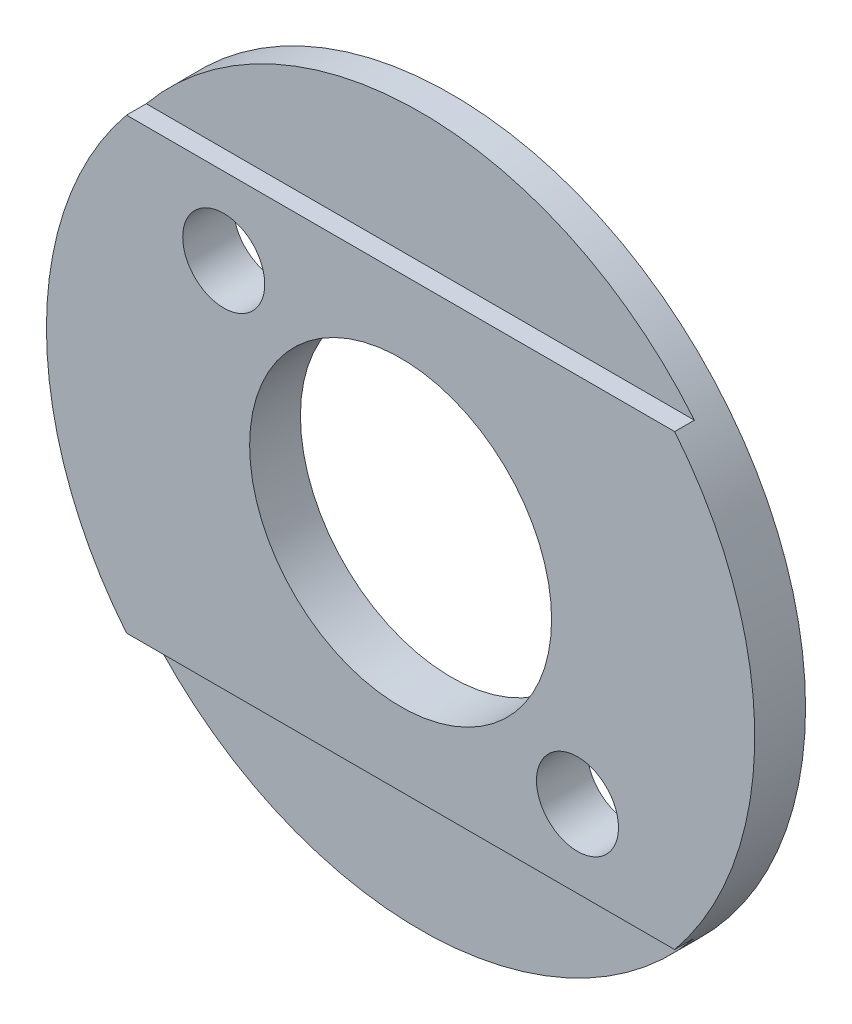
from build123d import *
from build123d.topology import SkipClean

# Parameters (mm, degrees)
SKETCH1_R           = 3.3
SKETCH1_R_2         = 12.15
BOSS_EXTRUDE1_DEPTH = 1.5875
BOSS_EXTRUDE2_START = 2.5
SKETCH2_R           = 28.5
SKETCH2_R_2         = 3.3
SKETCH2_R_3         = 12.15
BOSS_EXTRUDE2_DEPTH = 2.5


with BuildPart() as part:
    # Sketch1 → Boss-Extrude1 (new body)
    with BuildSketch(Plane.XY):
        with BuildLine():
            Line((-4.652672523, -60.083596209), (-48.763782235, -60.083596209))
            ThreePointArc((-48.763782235, -60.083596209), (-55.208227379, -78.133596209), (-48.763782235, -96.183596209))
            Line((-48.763782235, -96.183596209), (-4.652672523, -96.183596209))
            ThreePointArc((-4.652672523, -96.183596209), (0.132351167, -87.716567737), (1.791772621, -78.133596209))
            ThreePointArc((1.791772621, -78.133596209), (0.132351167, -68.550624681), (-4.652672523, -60.083596209))
        make_face()
        with Locations((-12.47433561, -89.950800833)):
            Circle(SKETCH1_R, mode=Mode.SUBTRACT)
        with Locations((-26.708227379, -78.133596209)):
            Circle(SKETCH1_R_2, mode=Mode.SUBTRACT)
        with Locations((-40.942119147, -66.316391585)):
            Circle(SKETCH1_R, mode=Mode.SUBTRACT)
    extrude(amount=BOSS_EXTRUDE1_DEPTH)

    # Sketch2 → Boss-Extrude2 (add)
    with SkipClean():  # the faces are left unmerged after this step: merging them gives an invalid solid
        with BuildSketch(Plane(origin=(0, 0, 0), x_dir=(-1, 0, 0), z_dir=(0, 0, -1)).offset(BOSS_EXTRUDE2_START)):
            with Locations((26.708227379, -78.133596209)):
                Circle(SKETCH2_R)
            with Locations((40.942119147, -66.316391585)):
                Circle(SKETCH2_R_2, mode=Mode.SUBTRACT)
            with Locations((12.47433561, -89.950800833)):
                Circle(SKETCH2_R_2, mode=Mode.SUBTRACT)
            with Locations((26.708227379, -78.133596209)):
                Circle(SKETCH2_R_3, mode=Mode.SUBTRACT)
        extrude(amount=-BOSS_EXTRUDE2_DEPTH)


solid = part.part
